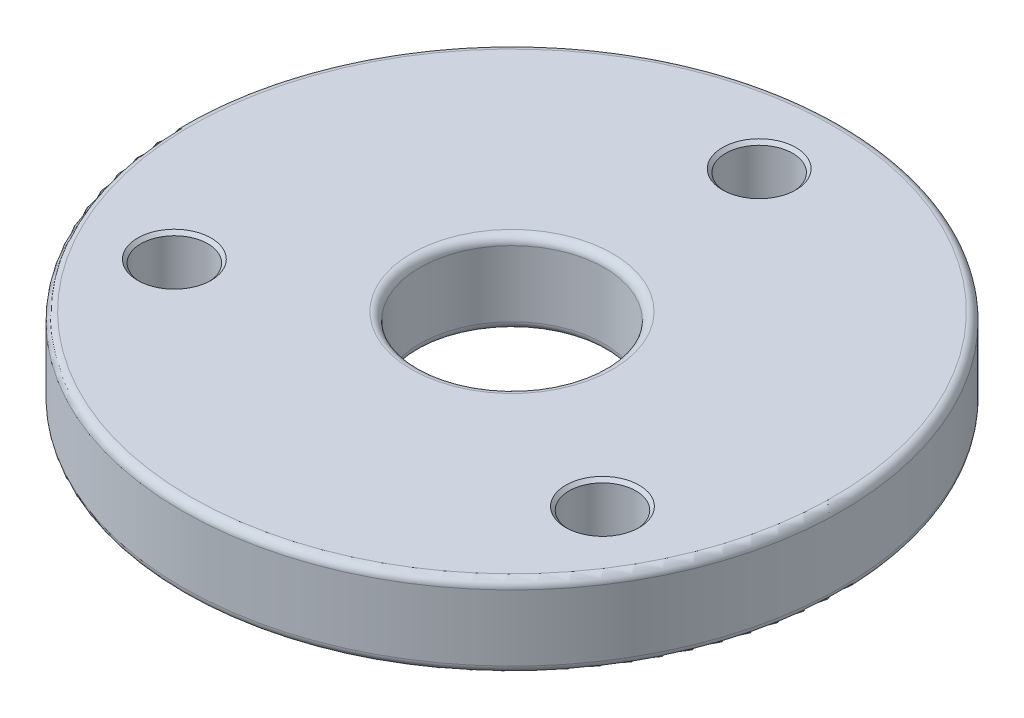
from build123d import *

# Parameters (mm, degrees)
SKETCH1_R           = 100
SKETCH1_R_2         = 28
SKETCH1_R_3         = 10.15
BOSS_EXTRUDE1_DEPTH = 12.5
FILLET1_R           = 2.5
CHAMFER1_SIZE       = 1


with BuildPart() as part:
    # Sketch1 → Boss-Extrude1 (new, symmetric)
    with BuildSketch(Plane(origin=(0, 0, 0), x_dir=(1, 0, 0), z_dir=(0, 1, 0))):
        with Locations(Location((0, 0, 0), (0, 0, 270))):
            Circle(SKETCH1_R)
        with Locations(Location((0, 0, 0), (0, 0, 270))):
            Circle(SKETCH1_R_2, mode=Mode.SUBTRACT)
        with Locations(Location((0, 75, 0), (0, 0, 270))):
            Circle(SKETCH1_R_3, mode=Mode.SUBTRACT)
        with Locations(Location((64.951905284, -37.5, 0), (0, 0, 270))):
            Circle(SKETCH1_R_3, mode=Mode.SUBTRACT)
        with Locations(Location((-64.951905284, -37.5, 0), (0, 0, 270))):
            Circle(SKETCH1_R_3, mode=Mode.SUBTRACT)
    extrude(amount=BOSS_EXTRUDE1_DEPTH, both=True)

    # Fillet1
    fillet1_edges = [part.edges().sort_by_distance(p)[0] for p in [
        (0, -12.5, -100),
        (0, 12.5, -100),
        (0, -12.5, -28),
        (0, 12.5, -28),
    ]]
    fillet(fillet1_edges, radius=FILLET1_R)

    # Chamfer1
    chamfer1_edges = [part.edges().sort_by_distance(p)[0] for p in [
        (64.951905284, -12.5, 27.35),
        (64.951905284, 12.5, 27.35),
        (-64.951905284, -12.5, 27.35),
        (-64.951905284, 12.5, 27.35),
        (0, -12.5, -85.15),
        (0, 12.5, -85.15),
    ]]
    chamfer(chamfer1_edges, length=CHAMFER1_SIZE)


solid = part.part
